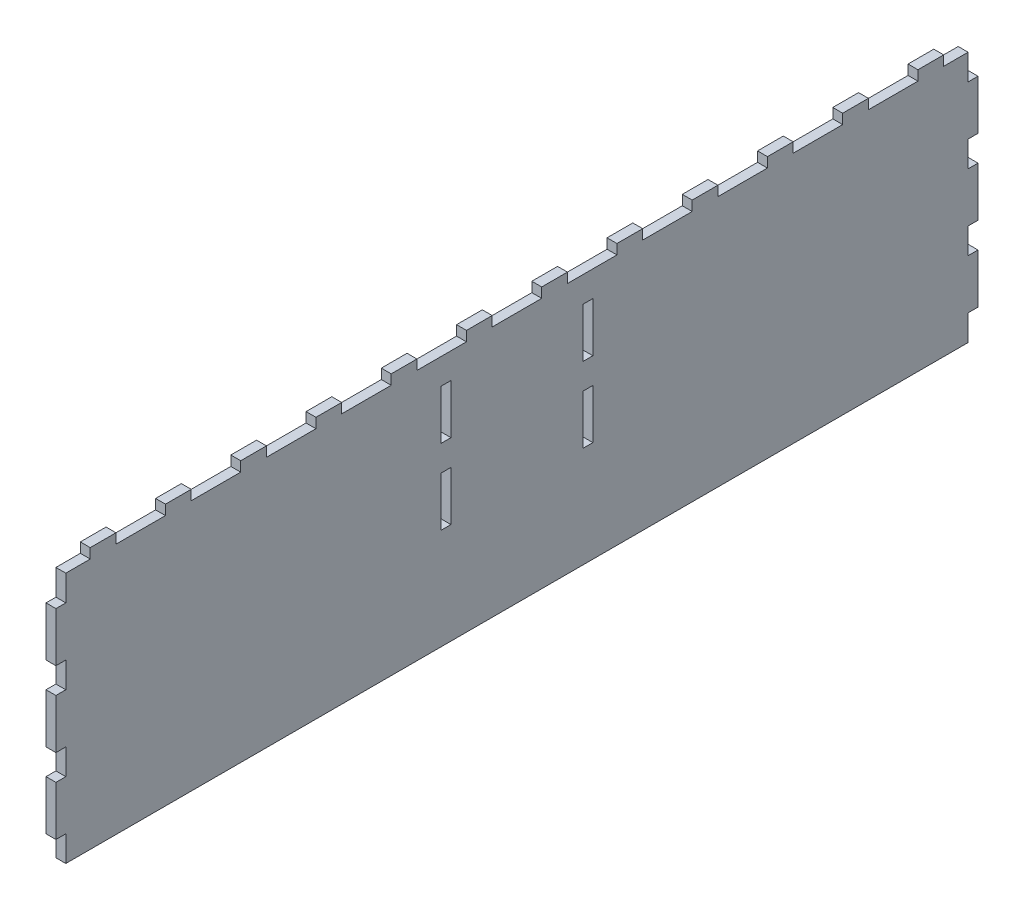
from build123d import *

# Parameters (mm, degrees)
SKETCH1_W               = 279.4
SKETCH1_H               = 76.2
BOSS_EXTRUDE1_DEPTH     = 3
SKETCH3_W               = 3
SKETCH3_H               = 7.8
CUT_EXTRUDE1_DEPTH      = 145.833352512
LPATTERN1_COUNT         = 4
LPATTERN1_PITCH         = 22.8
MIRROR1_COPY_1_SKETCH_W = 3
MIRROR1_COPY_1_SKETCH_H = 7.8
MIRROR1_COPY_1_DEPTH    = 145.833352512
MIRROR1_COPY_2_SKETCH_W = 3
MIRROR1_COPY_2_SKETCH_H = 7.8
MIRROR1_COPY_2_DEPTH    = 145.833352512
MIRROR1_COPY_3_SKETCH_W = 3
MIRROR1_COPY_3_SKETCH_H = 7.8
MIRROR1_COPY_3_DEPTH    = 145.833352512
SKETCH5_W               = 3
SKETCH5_H               = 15
CUT_EXTRUDE3_DEPTH      = 10
SKETCH9_W               = 3
SKETCH9_H               = 7.8
BOSS_EXTRUDE2_DEPTH     = 3
LPATTERN4_COUNT         = 12
LPATTERN4_PITCH         = 22.8
LPATTERN5_COUNT         = 2
LPATTERN5_PITCH         = 22.8
MIRROR2_COPY_1_SKETCH_W = 3
MIRROR2_COPY_1_SKETCH_H = 15
MIRROR2_COPY_1_DEPTH    = 10


with BuildPart() as part:
    # Sketch1 → Boss-Extrude1 (new body)
    with BuildSketch(Plane(origin=(0, 0, 0), x_dir=(0, 0, -1), z_dir=(1, 0, 0))):
        Rectangle(SKETCH1_W, SKETCH1_H)
    extrude(amount=-BOSS_EXTRUDE1_DEPTH)

    # Sketch3 → Cut-Extrude1 (cut, through all)
    with BuildSketch(Plane.ZY.offset(3)):
        with Locations((-138.2, 34.2)):
            Rectangle(SKETCH3_W, SKETCH3_H)
    cut_extrude1 = extrude(amount=-CUT_EXTRUDE1_DEPTH, mode=Mode.SUBTRACT)

    # LPattern1: Cut-Extrude1 ×4
    with Locations(*[(0, -i * LPATTERN1_PITCH, 0) for i in range(1, LPATTERN1_COUNT)]):
        add(cut_extrude1, mode=Mode.SUBTRACT)

    # Mirror1: Cut-Extrude1 across plane
    add(cut_extrude1.mirror(Plane.XY), mode=Mode.SUBTRACT)

    # Mirror1 copy 1 sketch → Mirror1 copy 1 (cut, through all)
    with BuildSketch(Plane(origin=(-3, -22.8, 0), x_dir=(0, 0, -1), z_dir=(-1, 0, 0))):
        with Locations((-138.2, -34.2)):
            Rectangle(MIRROR1_COPY_1_SKETCH_W, MIRROR1_COPY_1_SKETCH_H)
    extrude(amount=-MIRROR1_COPY_1_DEPTH, mode=Mode.SUBTRACT)

    # Mirror1 copy 2 sketch → Mirror1 copy 2 (cut, through all)
    with BuildSketch(Plane(origin=(-3, -45.6, 0), x_dir=(0, 0, -1), z_dir=(-1, 0, 0))):
        with Locations((-138.2, -34.2)):
            Rectangle(MIRROR1_COPY_2_SKETCH_W, MIRROR1_COPY_2_SKETCH_H)
    extrude(amount=-MIRROR1_COPY_2_DEPTH, mode=Mode.SUBTRACT)

    # Mirror1 copy 3 sketch → Mirror1 copy 3 (cut, through all)
    with BuildSketch(Plane(origin=(-3, -68.4, 0), x_dir=(0, 0, -1), z_dir=(-1, 0, 0))):
        with Locations((-138.2, -34.2)):
            Rectangle(MIRROR1_COPY_3_SKETCH_W, MIRROR1_COPY_3_SKETCH_H)
    extrude(amount=-MIRROR1_COPY_3_DEPTH, mode=Mode.SUBTRACT)

    # Sketch5 → Cut-Extrude3 (cut)
    with BuildSketch(Plane.ZY.offset(3)):
        with Locations((-21.5, 22.8)):
            Rectangle(SKETCH5_W, SKETCH5_H)
    cut_extrude3 = extrude(amount=-CUT_EXTRUDE3_DEPTH, mode=Mode.SUBTRACT)

    # Sketch9 → Boss-Extrude2 (add)
    with BuildSketch(Plane(origin=(0, 38.1, 0), x_dir=(1, 0, 0), z_dir=(0, 1, 0))):
        with Locations((-1.5, 125.4)):
            Rectangle(SKETCH9_W, SKETCH9_H)
    boss_extrude2 = extrude(amount=BOSS_EXTRUDE2_DEPTH)

    # LPattern4: Boss-Extrude2 ×12
    with Locations(*[(0, 0, i * LPATTERN4_PITCH) for i in range(1, LPATTERN4_COUNT)]):
        add(boss_extrude2)

    # LPattern5: Cut-Extrude3 ×2
    with Locations(*[(0, -i * LPATTERN5_PITCH, 0) for i in range(1, LPATTERN5_COUNT)]):
        add(cut_extrude3, mode=Mode.SUBTRACT)

    # Mirror2: Cut-Extrude3 across plane
    add(cut_extrude3.mirror(Plane.XY), mode=Mode.SUBTRACT)

    # Mirror2 copy 1 sketch → Mirror2 copy 1 (cut)
    with BuildSketch(Plane(origin=(-3, -22.8, 0), x_dir=(0, 0, -1), z_dir=(-1, 0, 0))):
        with Locations((-21.5, -22.8)):
            Rectangle(MIRROR2_COPY_1_SKETCH_W, MIRROR2_COPY_1_SKETCH_H)
    extrude(amount=-MIRROR2_COPY_1_DEPTH, mode=Mode.SUBTRACT)


solid = part.part
